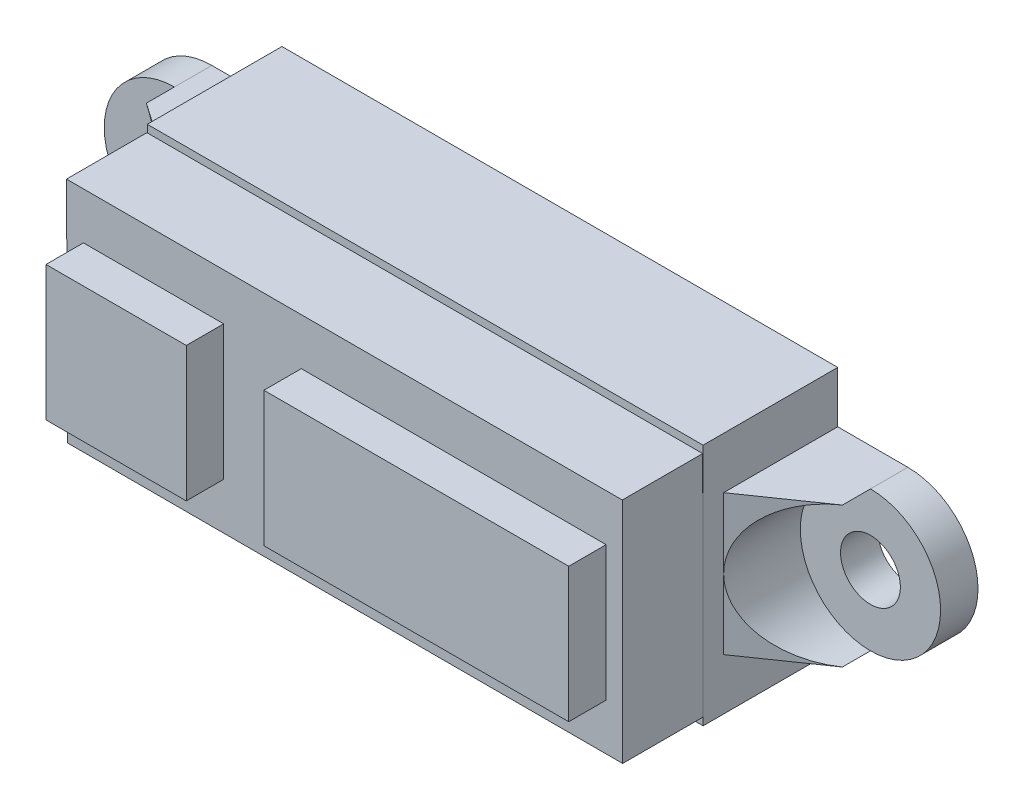
from build123d import *

# Parameters (mm, degrees)
SKETCH1_W           = 29.718
SKETCH1_H           = 13
BOSS_EXTRUDE1_DEPTH = 7.2
BOSS_EXTRUDE2_DEPTH = 4.3
SKETCH3_W           = 7.5
SKETCH3_H           = 7.2
SKETCH3_W_2         = 16.3
BOSS_EXTRUDE3_DEPTH = 2
SKETCH4_R           = 1.6
BOSS_EXTRUDE6_DEPTH = 2
SKETCH6_W           = 10.1
SKETCH6_H           = 6
BOSS_EXTRUDE7_DEPTH = 5
SKETCH7_W           = 3.75
SKETCH7_H           = 7.5
BOSS_EXTRUDE8_DEPTH = 4.1
CUT_EXTRUDE1_START  = -4.1
SKETCH8_R           = 3.75
CUT_EXTRUDE1_DEPTH  = 4.1
CUT_EXTRUDE2_DEPTH  = 31.760971717


with BuildPart() as part:
    # Sketch1 → Boss-Extrude1 (new body)
    with BuildSketch(Plane.XY):
        Rectangle(SKETCH1_W, SKETCH1_H)
    extrude(amount=BOSS_EXTRUDE1_DEPTH)

    # Sketch2 → Boss-Extrude2 (add)
    with BuildSketch(Plane.XY.offset(7.2)):
        Polygon((-14.879692304, 6.100162695), (14.838307696, 6.100162695), (14.859, -6.091679561), (-14.817672943, -6.091679561), align=None)
    extrude(amount=BOSS_EXTRUDE2_DEPTH)

    # Sketch3 → Boss-Extrude3 (add)
    with BuildSketch(Plane.XY.offset(11.5)):
        with Locations((-10.225, 0)):
            Rectangle(SKETCH3_W, SKETCH3_H)
        with Locations((5.825, 0)):
            Rectangle(SKETCH3_W_2, SKETCH3_H)
    extrude(amount=BOSS_EXTRUDE3_DEPTH)

    # Sketch4 → Boss-Extrude6 (add)
    # profile 1 of 2: a face of its own
    with BuildSketch(Plane(origin=(0, 0, 0), x_dir=(-1, 0, 0), z_dir=(0, 0, -1))):
        with BuildLine():
            Line((-14.859, 3.75), (-14.859, -3.75))
            Line((-14.859, -3.75), (-18.609, -3.75))
            ThreePointArc((-18.609, -3.75), (-22.359, 0), (-18.609, 3.75))
            Line((-18.609, 3.75), (-14.859, 3.75))
        make_face()
        with Locations(Location((-18.609, 0, 0), (0, 0, 180))):
            Circle(SKETCH4_R, mode=Mode.SUBTRACT)
    # profile 2 of 2: a face of its own
    with BuildSketch(Plane(origin=(0, 0, 0), x_dir=(-1, 0, 0), z_dir=(0, 0, -1))):
        with BuildLine():
            Line((18.609, 3.75), (14.859, 3.75))
            Line((14.859, 3.75), (14.859, -3.75))
            Line((14.859, -3.75), (18.609, -3.75))
            ThreePointArc((18.609, -3.75), (22.359, 0), (18.609, 3.75))
        make_face()
        with Locations((18.609, 0)):
            Circle(SKETCH4_R, mode=Mode.SUBTRACT)
    extrude(amount=-BOSS_EXTRUDE6_DEPTH)

    # Sketch6 → Boss-Extrude7 (add)
    with BuildSketch(Plane(origin=(0, 0, 0), x_dir=(-1, 0, 0), z_dir=(0, 0, -1))):
        with Locations((0, -9.5)):
            Rectangle(SKETCH6_W, SKETCH6_H)
    extrude(amount=-BOSS_EXTRUDE7_DEPTH)

    # Sketch7 → Boss-Extrude8 (add)
    with BuildSketch(Plane.XY.offset(2)):
        with Locations((-16.734, 0)):
            Rectangle(SKETCH7_W, SKETCH7_H)
        with Locations((16.734, 0)):
            Rectangle(SKETCH7_W, SKETCH7_H)
    extrude(amount=BOSS_EXTRUDE8_DEPTH)

    # Sketch8 → Cut-Extrude1 (cut)
    with BuildSketch(Plane.XY.offset(6.1).offset(CUT_EXTRUDE1_START)):
        with Locations((-18.609, 0)):
            Circle(SKETCH8_R)
        with Locations((18.609, 0)):
            Circle(SKETCH8_R)
    extrude(amount=CUT_EXTRUDE1_DEPTH, mode=Mode.SUBTRACT)

    # Sketch9 → Cut-Extrude2 (cut, through all)
    with BuildSketch(Plane(origin=(0, 3.75, 0), x_dir=(1, 0, 0), z_dir=(0, 1, 0))):
        Polygon((-18.609, -3.5), (-14.859, -6.1), (-18.609, -6.1), align=None)
        Polygon((18.609, -6.1), (18.609, -3.5), (14.859, -6.1), align=None)
    extrude(amount=-CUT_EXTRUDE2_DEPTH, mode=Mode.SUBTRACT)


solid = part.part
